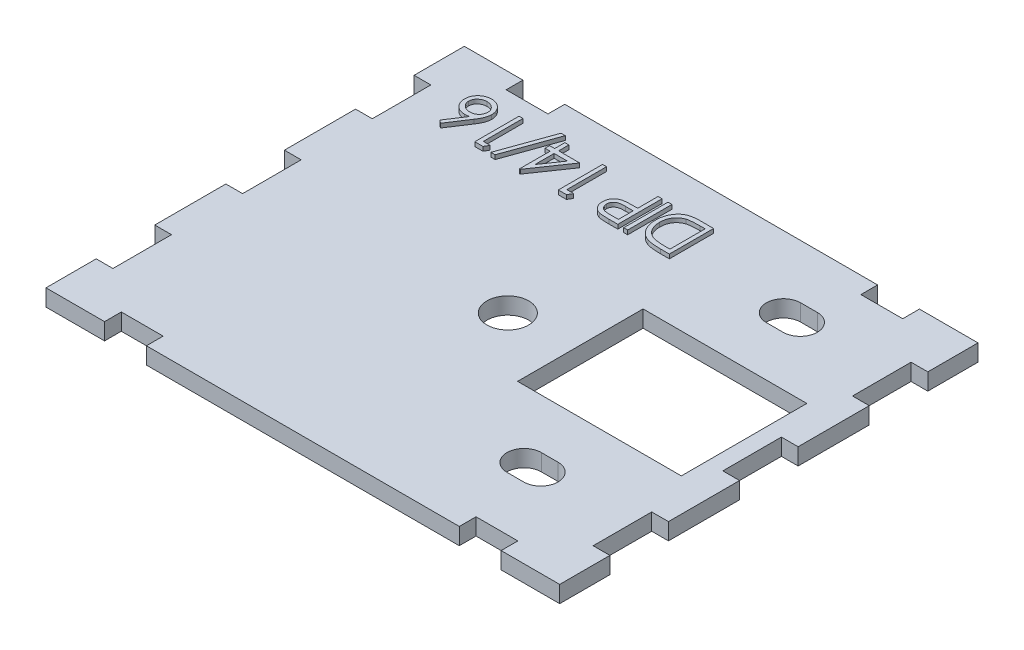
from build123d import *

# Parameters (mm, degrees)
SKETCH2_W           = 100
SKETCH2_H           = 50
BOSS_EXTRUDE1_DEPTH = 2
SKETCH12_W          = 9.8
SKETCH12_H          = 50
SKETCH12_W_2        = 8.8
CUT_EXTRUDE8_DEPTH  = 6
SKETCH13_W          = 2
SKETCH13_H          = 7
SKETCH13_W_2        = 5
SKETCH13_H_2        = 2
CUT_EXTRUDE10_DEPTH = 6
SKETCH15_W          = 6.543059906
SKETCH15_H          = 1
CUT_EXTRUDE13_DEPTH = 10
SKETCH16_R          = 2.5
CUT_EXTRUDE14_DEPTH = 10
SKETCH17_R          = 2.05
CUT_EXTRUDE15_DEPTH = 3.5
SKETCH22_W          = 0.474893163
SKETCH22_H          = 5.291666667
BOSS_EXTRUDE4_DEPTH = 0.5


with BuildPart() as part:
    # Sketch2 → Boss-Extrude1 (new body)
    with BuildSketch(Plane(origin=(0, 0, 0), x_dir=(1, 0, 0), z_dir=(0, 1, 0))):
        Rectangle(SKETCH2_W, SKETCH2_H)
    extrude(amount=BOSS_EXTRUDE1_DEPTH)

    # Sketch12 → Cut-Extrude8 (cut)
    with BuildSketch(Plane(origin=(0, 2, 0), x_dir=(1, 0, 0), z_dir=(0, 1, 0))):
        with Locations((-45.1, 0)):
            Rectangle(SKETCH12_W, SKETCH12_H)
        with Locations((45.6, 0)):
            Rectangle(SKETCH12_W_2, SKETCH12_H)
    extrude(amount=-CUT_EXTRUDE8_DEPTH, mode=Mode.SUBTRACT)

    # Sketch13 → Cut-Extrude10 (cut)
    with BuildSketch(Plane(origin=(0, 2, 0), x_dir=(1, 0, 0), z_dir=(0, 1, 0))):
        with Locations((-29.2, 0)):
            Rectangle(SKETCH13_W, SKETCH13_H)
        Polygon((-30.2, 12), (-30.2, 19), (-30.2, 25), (-40.2, 25), (-40.2, -25), (-30.2, -25), (-30.2, -19), (-30.2, -12), (-30.2, -3.5), (-30.2, 3.5), align=None)
        with Locations((-29.2, 15.5)):
            Rectangle(SKETCH13_W, SKETCH13_H)
        with Locations((21.7, -24)):
            Rectangle(SKETCH13_W_2, SKETCH13_H_2)
        with Locations((30.2, -15.5)):
            Rectangle(SKETCH13_W, SKETCH13_H)
        with Locations((30.2, 0)):
            Rectangle(SKETCH13_W, SKETCH13_H)
        with Locations((30.2, 15.5)):
            Rectangle(SKETCH13_W, SKETCH13_H)
        with Locations((21.7, 24)):
            Rectangle(SKETCH13_W_2, SKETCH13_H_2)
        with Locations((-29.2, -15.5)):
            Rectangle(SKETCH13_W, SKETCH13_H)
        Polygon((41.2, 25), (31.2, 25), (31.2, 19), (31.2, 12), (31.2, 3.5), (31.2, -3.5), (31.2, -12), (31.2, -19), (31.2, -25), (41.2, -25), align=None)
        with Locations((-20.7, 24)):
            Rectangle(SKETCH13_W_2, SKETCH13_H_2)
        with Locations((-20.7, -24)):
            Rectangle(SKETCH13_W_2, SKETCH13_H_2)
    extrude(amount=-CUT_EXTRUDE10_DEPTH, mode=Mode.SUBTRACT)

    # Sketch15 → Cut-Extrude13 (cut)
    with BuildSketch(Plane.XZ):
        Polygon((8.96933351, -7.5), (14.181143059, -7.5), (20.724202965, -7.5), (25.936012514, -7.5), (25.936012514, 5.5), (8.96933351, 5.5), align=None)
        Polygon((27.239237886, -8.5), (20.724202965, -8.5), (20.724202965, -7.5), (25.936012514, -7.5), (25.936012514, 5.5), (8.96933351, 5.5), (8.96933351, -7.5), (14.181143059, -7.5), (14.181143059, -8.5), (7.666108138, -8.5), (7.666108138, 6.5), (27.239237886, 6.5), align=None)
        with Locations((17.452673012, -8)):
            Rectangle(SKETCH15_W, SKETCH15_H)
    extrude(amount=-CUT_EXTRUDE13_DEPTH, mode=Mode.SUBTRACT)

    # Sketch16 → Cut-Extrude14 (cut)
    with BuildSketch(Plane(origin=(0, 0, 0), x_dir=(-1, 0, 0), z_dir=(0, -1, 0))):
        with Locations(Location((0, 0, 0), (0, 0, 90))):
            Circle(SKETCH16_R)
    extrude(amount=-CUT_EXTRUDE14_DEPTH, mode=Mode.SUBTRACT)

    # Sketch17 → Cut-Extrude15 (cut)
    with BuildSketch(Plane(origin=(0, 0, 0), x_dir=(-1, 0, 0), z_dir=(0, -1, 0))):
        with Locations((-18.452672908, -14.5)):
            Circle(SKETCH17_R)
        with Locations((-17.452672908, -14.5)):
            Circle(SKETCH17_R)
        with Locations((-16.452672908, -14.5)):
            Circle(SKETCH17_R)
        with BuildLine():
            ThreePointArc((-16.952672908, -12.511910465), (-16.704582071, -12.46553649), (-16.452672908, -12.45))
            Line((-16.452672908, -12.45), (-17.452672908, -12.45))
            ThreePointArc((-17.452672908, -12.45), (-17.200763745, -12.46553649), (-16.952672908, -12.511910465))
        make_face()
        with BuildLine():
            ThreePointArc((-17.952672908, -12.511910465), (-17.704582071, -12.46553649), (-17.452672908, -12.45))
            Line((-17.452672908, -12.45), (-18.452672908, -12.45))
            ThreePointArc((-18.452672908, -12.45), (-18.200763745, -12.46553649), (-17.952672908, -12.511910465))
        make_face()
        with BuildLine():
            Line((-17.452672856, -16.55), (-16.452672908, -16.55))
            ThreePointArc((-16.452672908, -16.55), (-16.704582071, -16.53446351), (-16.952672908, -16.488089535))
            ThreePointArc((-16.952672908, -16.488089535), (-17.200763719, -16.534463507), (-17.452672856, -16.55))
        make_face()
        with BuildLine():
            ThreePointArc((-17.952672908, -16.488089535), (-18.200763745, -16.53446351), (-18.452672908, -16.55))
            Line((-18.452672908, -16.55), (-17.452672856, -16.55))
            ThreePointArc((-17.452672856, -16.55), (-17.704582045, -16.534463513), (-17.952672908, -16.488089535))
        make_face()
        with Locations((-16.452672903, 16.5)):
            Circle(SKETCH17_R)
        with Locations((-18.452672903, 16.5)):
            Circle(SKETCH17_R)
        with Locations((-17.452672903, 16.5)):
            Circle(SKETCH17_R)
        with BuildLine():
            Line((-17.452672915, 14.45), (-16.452672903, 14.45))
            ThreePointArc((-16.452672903, 14.45), (-16.704582066, 14.46553649), (-16.952672903, 14.511910465))
            ThreePointArc((-16.952672903, 14.511910465), (-17.200763746, 14.465536489), (-17.452672915, 14.45))
        make_face()
        with BuildLine():
            ThreePointArc((-17.952672903, 14.511910465), (-18.20076374, 14.46553649), (-18.452672903, 14.45))
            Line((-18.452672903, 14.45), (-17.452672915, 14.45))
            ThreePointArc((-17.452672915, 14.45), (-17.704582072, 14.465536491), (-17.952672903, 14.511910465))
        make_face()
        with BuildLine():
            ThreePointArc((-17.952672903, 18.488089535), (-17.70458205, 18.534463512), (-17.452672871, 18.55))
            Line((-17.452672871, 18.55), (-18.452672903, 18.55))
            ThreePointArc((-18.452672903, 18.55), (-18.20076374, 18.53446351), (-17.952672903, 18.488089535))
        make_face()
        with BuildLine():
            ThreePointArc((-16.952672903, 18.488089535), (-16.704582066, 18.53446351), (-16.452672903, 18.55))
            Line((-16.452672903, 18.55), (-17.452672871, 18.55))
            ThreePointArc((-17.452672871, 18.55), (-17.200763724, 18.534463508), (-16.952672903, 18.488089535))
        make_face()
    extrude(amount=-CUT_EXTRUDE15_DEPTH, mode=Mode.SUBTRACT)

    # Sketch22 → Boss-Extrude4 (add)
    # profile 1 of 8: a face of its own
    with BuildSketch(Plane(origin=(0, 2, 0), x_dir=(1, 0, 0), z_dir=(0, 1, 0))):
        with BuildLine():
            Line((-23.159052189, 15.112494657), (-23.524762325, 15.399762619))
            Line((-23.524762325, 15.399762619), (-22.126583573, 17.537841879))
            add(Edge.make_bspline(
                [(-22.126583573, 17.537841879), (-22.219671968, 17.523004256), (-22.401251407, 17.494061796), (-22.585047468, 17.489287283), (-22.674618762, 17.486960469)],
                knots=[0, 0, 0, 0, 1.025318673, 2, 2, 2, 2], degree=3))
            add(Edge.make_bspline(
                [(-22.674618762, 17.486960469), (-22.728400989, 17.488406018), (-22.834269702, 17.49125154), (-22.989703794, 17.513149744), (-23.139063263, 17.547659137), (-23.281729012, 17.597963628), (-23.418213242, 17.662223105), (-23.549298709, 17.739237958), (-23.672523131, 17.832984134), (-23.789466337, 17.937708107), (-23.895659433, 18.053689599), (-23.989604348, 18.176787003), (-24.068948676, 18.306990581), (-24.132162742, 18.444271056), (-24.182681976, 18.587553813), (-24.218645522, 18.737397667), (-24.240145071, 18.894055519), (-24.243047785, 19.000614982), (-24.244522275, 19.054743922)],
                knots=[0, 0, 0, 0, 1.043709831, 2.054511743, 3.041122595, 4.01515914, 4.98481438, 5.965901842, 6.960491961, 7.985277438, 9.0096037, 10.00832444, 10.987059228, 11.962929573, 12.936966118, 13.931840027, 14.949438142, 16, 16, 16, 16], degree=3))
            add(Edge.make_bspline(
                [(-24.244522275, 19.054743922), (-24.241765926, 19.128755292), (-24.236345282, 19.27430628), (-24.196736946, 19.487139407), (-24.128885773, 19.6881538), (-24.036650034, 19.877874324), (-23.919260098, 20.052327833), (-23.778459732, 20.209462737), (-23.614944089, 20.346427783), (-23.431968854, 20.46387291), (-23.233959581, 20.55719634), (-23.026333318, 20.626188817), (-22.81087333, 20.667414355), (-22.664546047, 20.672811573), (-22.590876441, 20.675528845)],
                knots=[0, 0, 0, 0, 1.0319111, 2.029359566, 3.00642934, 3.98275322, 4.962714161, 5.929339302, 6.915525103, 7.928435063, 8.953439721, 9.960121214, 10.9730072, 12, 12, 12, 12], degree=3))
            add(Edge.make_bspline(
                [(-22.590876441, 20.675528845), (-22.519667705, 20.673224915), (-22.378615665, 20.668661233), (-22.171176785, 20.627795186), (-21.97149938, 20.562029872), (-21.782151182, 20.469524897), (-21.606444215, 20.354659152), (-21.448040764, 20.217317659), (-21.310949007, 20.057411338), (-21.196443028, 19.877924088), (-21.102738703, 19.686574339), (-21.037266108, 19.484880236), (-20.99469769, 19.277021826), (-20.990317061, 19.135513905), (-20.988112018, 19.064284187)],
                knots=[0, 0, 0, 0, 1.01206923, 2.004731945, 2.994948482, 3.995280086, 4.993424783, 5.973125358, 6.967517142, 7.97830003, 8.994392566, 9.989381197, 10.98793077, 12, 12, 12, 12], degree=3))
            add(Edge.make_bspline(
                [(-20.988112018, 19.064284187), (-20.990029791, 19.009808052), (-20.993943775, 18.89862769), (-21.017301978, 18.729754823), (-21.060143777, 18.557638732), (-21.106507967, 18.411731376), (-21.152515239, 18.290893649), (-21.19517424, 18.195471289), (-21.242872201, 18.094702212), (-21.298780854, 17.990493069), (-21.358048538, 17.87986638), (-21.427279919, 17.766918987), (-21.499523929, 17.647525704), (-21.552448048, 17.568035511), (-21.579608413, 17.527241585)],
                knots=[0, 0, 0, 0, 1.17367173, 2.395347028, 3.66355231, 4.98980831, 5.690886799, 6.447442954, 7.240630024, 8.091733897, 8.994365608, 9.943299771, 10.944512865, 12, 12, 12, 12], degree=3))
            Line((-21.579608413, 17.527241585), (-23.159052189, 15.112494657))
        make_face()
        with BuildLine():
            add(Edge.make_bspline(
                [(-22.574976001, 18.029695511), (-22.534662502, 18.03087597), (-22.455567751, 18.033192021), (-22.339738422, 18.046561522), (-22.230047885, 18.071031437), (-22.126676136, 18.105475267), (-22.028097607, 18.14755673), (-21.935878135, 18.200921224), (-21.849397085, 18.26367671), (-21.770651585, 18.335907419), (-21.698324803, 18.413782574), (-21.636116736, 18.497707287), (-21.58239629, 18.585101291), (-21.538733411, 18.676790235), (-21.50472957, 18.772714198), (-21.480133793, 18.872438601), (-21.466445311, 18.976630388), (-21.464168042, 19.047285492), (-21.463005181, 19.083364716)],
                knots=[0, 0, 0, 0, 1.129540697, 2.216149546, 3.260829642, 4.271906843, 5.264942922, 6.258225651, 7.250175744, 8.252297429, 9.247108021, 10.223125336, 11.173816288, 12.116901384, 13.062424938, 14.020354563, 14.989116641, 16, 16, 16, 16], degree=3))
            add(Edge.make_bspline(
                [(-21.463005181, 19.083364716), (-21.463988153, 19.119113629), (-21.465925219, 19.189561247), (-21.482341495, 19.292994567), (-21.508766599, 19.392212555), (-21.546331833, 19.487424507), (-21.594322411, 19.578485658), (-21.651721669, 19.666496828), (-21.721323215, 19.749115262), (-21.800392034, 19.826850859), (-21.886309432, 19.897985284), (-21.976984215, 19.961583672), (-22.072741738, 20.014371593), (-22.172562209, 20.058494797), (-22.277699679, 20.090910769), (-22.386373704, 20.115745095), (-22.500081835, 20.129318439), (-22.577063515, 20.131620143), (-22.616317147, 20.132793802)],
                knots=[0, 0, 0, 0, 0.98953633, 1.950002717, 2.892353065, 3.828177645, 4.777967117, 5.738732544, 6.732276577, 7.76327951, 8.805689376, 9.818183401, 10.825652611, 11.829169732, 12.834974292, 13.867693979, 14.912718532, 16, 16, 16, 16], degree=3))
            add(Edge.make_bspline(
                [(-22.616317147, 20.132793802), (-22.655570842, 20.131620234), (-22.732552648, 20.129318709), (-22.846259864, 20.115744067), (-22.95493727, 20.090914538), (-23.060062461, 20.05848114), (-23.159928471, 20.014422563), (-23.25576977, 19.961250923), (-23.347310327, 19.89837083), (-23.433171848, 19.826727849), (-23.512570636, 19.749556235), (-23.580572843, 19.665741616), (-23.63982321, 19.579178297), (-23.685983563, 19.487062309), (-23.723969395, 19.392269174), (-23.750265041, 19.292979114), (-23.766716316, 19.189565278), (-23.768648578, 19.119114986), (-23.769629112, 19.083364716)],
                knots=[0, 0, 0, 0, 1.087095469, 2.131941252, 3.164484274, 4.170116773, 5.173462224, 6.180759088, 7.201132453, 8.243363996, 9.274190558, 10.261329848, 11.227346438, 12.172477233, 13.108141724, 14.050330866, 15.010632948, 16, 16, 16, 16], degree=3))
            add(Edge.make_bspline(
                [(-23.769629112, 19.083364716), (-23.768806819, 19.047234237), (-23.767192925, 18.976321857), (-23.748585395, 18.872532474), (-23.723452835, 18.771903275), (-23.682836289, 18.676701171), (-23.634458761, 18.584293153), (-23.572828602, 18.49732141), (-23.502169511, 18.413317685), (-23.420333972, 18.335391229), (-23.331324788, 18.264063045), (-23.236594471, 18.201288289), (-23.137888309, 18.147701805), (-23.033811125, 18.105418248), (-22.925764521, 18.071354019), (-22.813002083, 18.046725423), (-22.695443701, 18.033171205), (-22.61564337, 18.030868833), (-22.574976001, 18.029695511)],
                knots=[0, 0, 0, 0, 0.978317929, 1.920119929, 2.851929572, 3.784133089, 4.71845084, 5.67514162, 6.667477147, 7.690549442, 8.733345855, 9.756283585, 10.767808623, 11.772962645, 12.797066014, 13.836159554, 14.89727653, 16, 16, 16, 16], degree=3))
        make_face(mode=Mode.SUBTRACT)
    # profile 2 of 8: a face of its own
    with BuildSketch(Plane(origin=(0, 2, 0), x_dir=(1, 0, 0), z_dir=(0, 1, 0))):
        Polygon((-18.218679259, 15.248178417), (-19.197086377, 15.248178417), (-19.197086377, 20.539845084), (-18.722193215, 20.539845084), (-18.722193215, 15.79091346), (-17.908090651, 15.79091346), align=None)
    # profile 3 of 8: a face of its own
    with BuildSketch(Plane(origin=(0, 2, 0), x_dir=(1, 0, 0), z_dir=(0, 1, 0))):
        Polygon((-17.134693215, 15.112494657), (-14.921351869, 21.286105768), (-14.421018001, 21.286105768), (-16.634359347, 15.112494657), align=None)
    # profile 4 of 8: a face of its own
    with BuildSketch(Plane(origin=(0, 2, 0), x_dir=(1, 0, 0), z_dir=(0, 1, 0))):
        Polygon((-13.618999772, 15.112494657), (-13.715462446, 15.112494657), (-13.715462446, 18.775956195), (-14.326039369, 18.775956195), (-14.326039369, 19.318691238), (-13.715462446, 19.318691238), (-13.715462446, 20.539845084), (-13.240569283, 20.539845084), (-13.240569283, 19.318691238), (-10.730419711, 19.318691238), align=None)
        Polygon((-13.240569283, 18.775956195), (-13.240569283, 16.477812499), (-11.663245565, 18.775956195), align=None, mode=Mode.SUBTRACT)
    # profile 5 of 8: a face of its own
    with BuildSketch(Plane(origin=(0, 2, 0), x_dir=(1, 0, 0), z_dir=(0, 1, 0))):
        Polygon((-8.232354473, 15.248178417), (-9.210761591, 15.248178417), (-9.210761591, 20.539845084), (-8.735868429, 20.539845084), (-8.735868429, 15.79091346), (-7.921765864, 15.79091346), align=None)
    # profile 6 of 8: a face of its own
    with BuildSketch(Plane(origin=(0, 2, 0), x_dir=(1, 0, 0), z_dir=(0, 1, 0))):
        with BuildLine():
            Line((-2.100932531, 15.248178417), (-3.138701295, 15.248178417))
            add(Edge.make_bspline(
                [(-3.138701295, 15.248178417), (-3.210079688, 15.24825688), (-3.346843861, 15.248407217), (-3.542960671, 15.252965225), (-3.721077765, 15.2590532), (-3.880811079, 15.267492491), (-4.022652085, 15.277465907), (-4.145958954, 15.29145411), (-4.251700903, 15.306059556), (-4.315059463, 15.320908588), (-4.3439547, 15.327680621)],
                knots=[0, 0, 0, 0, 1.415646017, 2.712440637, 3.8905458, 4.950247383, 5.884950622, 6.709939814, 7.411656543, 8, 8, 8, 8], degree=3))
            add(Edge.make_bspline(
                [(-4.3439547, 15.327680621), (-4.380532786, 15.337692681), (-4.452827043, 15.357480878), (-4.557002221, 15.39710916), (-4.656100908, 15.44411866), (-4.750537628, 15.497616299), (-4.838694573, 15.560128491), (-4.923324169, 15.628047242), (-5.002651614, 15.704119349), (-5.075479088, 15.788244656), (-5.142956887, 15.877667251), (-5.199440641, 15.974667362), (-5.249318019, 16.075880016), (-5.288187913, 16.18377635), (-5.318741144, 16.296932148), (-5.340993095, 16.415641918), (-5.355294899, 16.539649576), (-5.35665196, 16.624409671), (-5.357342788, 16.667557758)],
                knots=[0, 0, 0, 0, 0.999333726, 1.975119402, 2.933498163, 3.889020618, 4.832249799, 5.779334906, 6.747801194, 7.724875447, 8.710438469, 9.696133548, 10.679360639, 11.681339199, 12.714023775, 13.766351759, 14.862936069, 16, 16, 16, 16], degree=3))
            add(Edge.make_bspline(
                [(-5.357342788, 16.667557758), (-5.356705634, 16.711067015), (-5.355458999, 16.796195817), (-5.340496758, 16.920735628), (-5.320342777, 17.039750337), (-5.289353186, 17.152976053), (-5.248765085, 17.259740373), (-5.201152101, 17.361674855), (-5.14372462, 17.457045311), (-5.077737794, 17.546197977), (-5.004332408, 17.629216535), (-4.923819037, 17.705499379), (-4.836522726, 17.774599986), (-4.742720907, 17.836673267), (-4.641499111, 17.890279785), (-4.534392522, 17.938293806), (-4.420470171, 17.978617909), (-4.341635656, 17.999830026), (-4.301553525, 18.010614983)],
                knots=[0, 0, 0, 0, 1.121902311, 2.195077645, 3.232258892, 4.234102512, 5.217864754, 6.176164875, 7.132989551, 8.084763148, 9.034132444, 9.988522005, 10.94243251, 11.903244335, 12.886203696, 13.894208494, 14.929344452, 16, 16, 16, 16], degree=3))
            add(Edge.make_bspline(
                [(-4.301553525, 18.010614983), (-4.268401107, 18.017659712), (-4.195745655, 18.033098645), (-4.076096899, 18.050451574), (-3.936719505, 18.064682872), (-3.778087698, 18.077963633), (-3.599831552, 18.085000776), (-3.4023599, 18.09326353), (-3.185004433, 18.097162272), (-3.033405771, 18.097408721), (-2.954256182, 18.097537392)],
                knots=[0, 0, 0, 0, 0.601372724, 1.317943291, 2.144091499, 3.08771165, 4.142394186, 5.309582461, 6.595334295, 8, 8, 8, 8], degree=3))
            Line((-2.954256182, 18.097537392), (-2.575825694, 18.097537392))
            Line((-2.575825694, 18.097537392), (-2.575825694, 20.539845084))
            Line((-2.575825694, 20.539845084), (-2.100932531, 20.539845084))
            Line((-2.100932531, 20.539845084), (-2.100932531, 15.248178417))
        make_face()
        with BuildLine():
            Line((-2.575825694, 15.79091346), (-2.575825694, 17.554802349))
            Line((-2.575825694, 17.554802349), (-3.502291372, 17.566462672))
            add(Edge.make_bspline(
                [(-3.502291372, 17.566462672), (-3.547528212, 17.5664925), (-3.634856998, 17.566550082), (-3.761346729, 17.560421484), (-3.878417492, 17.553754261), (-3.986242138, 17.542971778), (-4.084328526, 17.529820509), (-4.172914136, 17.512237197), (-4.252705925, 17.494303354), (-4.344617228, 17.463184955), (-4.447567528, 17.4162389), (-4.559305061, 17.346119114), (-4.65477562, 17.257785816), (-4.736693945, 17.157394105), (-4.801444786, 17.045594913), (-4.848372528, 16.926308405), (-4.877016247, 16.799987531), (-4.88061652, 16.713641524), (-4.882449625, 16.669677816)],
                knots=[0, 0, 0, 0, 1.160501667, 2.240324542, 3.248665471, 4.168823117, 5.020172044, 5.786515869, 6.485785279, 7.116517804, 8.272762037, 9.381837012, 10.485674779, 11.594342068, 12.695271952, 13.786226926, 14.872841088, 16, 16, 16, 16], degree=3))
            add(Edge.make_bspline(
                [(-4.882449625, 16.669677816), (-4.880534738, 16.627138412), (-4.876728178, 16.54257534), (-4.848609135, 16.418581872), (-4.800947807, 16.300651465), (-4.736641157, 16.189738386), (-4.656685883, 16.089613502), (-4.563114035, 16.003248829), (-4.457381448, 15.933346739), (-4.359794665, 15.886813583), (-4.272462178, 15.859525505), (-4.196971187, 15.839824894), (-4.11130046, 15.826237802), (-4.016260762, 15.81323751), (-3.911973776, 15.802743445), (-3.797776365, 15.795456031), (-3.674048912, 15.791235826), (-3.588157142, 15.791023517), (-3.543632518, 15.79091346)],
                knots=[0, 0, 0, 0, 1.12039168, 2.227199994, 3.330242575, 4.460839274, 5.593542475, 6.693949254, 7.801736126, 8.92216649, 9.528704869, 10.210659466, 10.975987387, 11.81211542, 12.738540127, 13.736887663, 14.826846554, 16, 16, 16, 16], degree=3))
            Line((-3.543632518, 15.79091346), (-2.575825694, 15.79091346))
        make_face(mode=Mode.SUBTRACT)
    # profile 7 of 8: a face of its own
    with BuildSketch(Plane(origin=(0, 2, 0), x_dir=(1, 0, 0), z_dir=(0, 1, 0))):
        with Locations((-1.157930395, 17.89401175)):
            Rectangle(SKETCH22_W, SKETCH22_H)
    # profile 8 of 8: a face of its own
    with BuildSketch(Plane(origin=(0, 2, 0), x_dir=(1, 0, 0), z_dir=(0, 1, 0))):
        with BuildLine():
            Line((4.059110204, 20.539845084), (4.059110204, 15.248178417))
            Line((4.059110204, 15.248178417), (2.990600589, 15.248178417))
            add(Edge.make_bspline(
                [(2.990600589, 15.248178417), (2.897665139, 15.248845718), (2.718114335, 15.250134939), (2.458655247, 15.258355989), (2.218931722, 15.272752196), (1.999079898, 15.294126465), (1.798746565, 15.319781578), (1.61825258, 15.352408477), (1.457305437, 15.39077992), (1.358322072, 15.423507319), (1.31151405, 15.438983706)],
                knots=[0, 0, 0, 0, 1.314317071, 2.539253741, 3.67075822, 4.709970291, 5.662644612, 6.526156501, 7.303037452, 8, 8, 8, 8], degree=3))
            add(Edge.make_bspline(
                [(1.31151405, 15.438983706), (1.250284386, 15.462306224), (1.129213543, 15.508422383), (0.956925114, 15.595547119), (0.79418474, 15.693859614), (0.642277425, 15.805613833), (0.50086845, 15.929381688), (0.368178583, 16.064161799), (0.248011133, 16.21355234), (0.136221489, 16.372917778), (0.038376545, 16.543708371), (-0.047903892, 16.722503207), (-0.121574286, 16.908955371), (-0.179056982, 17.104425318), (-0.226547623, 17.307035637), (-0.258412678, 17.518320336), (-0.279579353, 17.737047608), (-0.281696109, 17.885479957), (-0.282770138, 17.960793602)],
                knots=[0, 0, 0, 0, 0.984696416, 1.947063185, 2.89840987, 3.841051395, 4.778753227, 5.721858861, 6.681155121, 7.65838316, 8.646299769, 9.637283673, 10.641736726, 11.657050558, 12.698485921, 13.768600492, 14.86780186, 16, 16, 16, 16], degree=3))
            add(Edge.make_bspline(
                [(-0.282770138, 17.960793602), (-0.281818558, 18.026200252), (-0.279943369, 18.155090889), (-0.263126086, 18.345051132), (-0.238635474, 18.529361241), (-0.200892726, 18.707211928), (-0.154515313, 18.879800613), (-0.09727376, 19.046310112), (-0.029427985, 19.206853596), (0.049253843, 19.360155912), (0.135407236, 19.505844287), (0.2292855, 19.641610381), (0.327674304, 19.768951073), (0.434162066, 19.884989597), (0.545223084, 19.993339426), (0.664634698, 20.089194152), (0.788657989, 20.177003811), (0.921018977, 20.254101774), (1.062803633, 20.322682703), (1.217715575, 20.38059971), (1.385189418, 20.430441608), (1.566334877, 20.470152222), (1.760547814, 20.502160991), (1.968354698, 20.523477188), (2.189366395, 20.53793223), (2.341130783, 20.539195085), (2.419244753, 20.539845084)],
                knots=[0, 0, 0, 0, 1.105894396, 2.179280415, 3.222964075, 4.248423888, 5.251546139, 6.243661943, 7.223682738, 8.196462441, 9.155694589, 10.083899862, 10.986397372, 11.874737962, 12.745335529, 13.607670254, 14.461432187, 15.313100333, 16.195087267, 17.121790994, 18.106827133, 19.14775296, 20.255889161, 21.433815148, 22.679170477, 24, 24, 24, 24], degree=3))
            Line((2.419244753, 20.539845084), (4.059110204, 20.539845084))
        make_face()
        with BuildLine():
            Line((3.584217041, 19.997110041), (2.976820207, 19.997110041))
            add(Edge.make_bspline(
                [(2.976820207, 19.997110041), (2.889540408, 19.996734943), (2.721669391, 19.996013492), (2.480281705, 19.98968284), (2.259725951, 19.979338482), (2.059970812, 19.964861876), (1.881129072, 19.945708137), (1.722826974, 19.924352629), (1.585583429, 19.897746959), (1.502535352, 19.873630628), (1.464158281, 19.86248631)],
                knots=[0, 0, 0, 0, 1.375205317, 2.645023457, 3.804390687, 4.853969522, 5.800190428, 6.637939096, 7.370582563, 8, 8, 8, 8], degree=3))
            add(Edge.make_bspline(
                [(1.464158281, 19.86248631), (1.415854374, 19.845476297), (1.320400297, 19.811862553), (1.183011593, 19.750524854), (1.054812317, 19.677957626), (0.93366525, 19.596817328), (0.820348968, 19.505851075), (0.715388227, 19.404769574), (0.617953968, 19.294743066), (0.529606207, 19.175400814), (0.449702666, 19.048066979), (0.380666269, 18.912883401), (0.322469368, 18.770608682), (0.27472268, 18.62173782), (0.237496636, 18.466182211), (0.211288036, 18.30355149), (0.195046874, 18.133909881), (0.193108267, 18.018425372), (0.192123024, 17.959733572)],
                knots=[0, 0, 0, 0, 0.998420628, 1.972994, 2.929372424, 3.86770908, 4.81360496, 5.759023883, 6.706048443, 7.676227424, 8.651287839, 9.634325482, 10.632389399, 11.645655052, 12.680158286, 13.74837235, 14.855672678, 16, 16, 16, 16], degree=3))
            add(Edge.make_bspline(
                [(0.192123024, 17.959733572), (0.192899893, 17.897846419), (0.194426059, 17.776268559), (0.213576683, 17.597872612), (0.241621998, 17.426319709), (0.281962995, 17.261486341), (0.334080085, 17.103586959), (0.396442407, 16.951729499), (0.472160056, 16.807868222), (0.557880439, 16.670784678), (0.654117268, 16.542554911), (0.76044364, 16.4246812), (0.875738409, 16.316943975), (0.999470216, 16.219171701), (1.133369041, 16.133103123), (1.275169053, 16.05653786), (1.426867694, 15.991483459), (1.532419828, 15.956895335), (1.58606166, 15.939317573)],
                knots=[0, 0, 0, 0, 1.122272916, 2.204715076, 3.251197285, 4.274229216, 5.279697671, 6.265416158, 7.248880903, 8.225321784, 9.195852973, 10.153576302, 11.101466393, 12.055578741, 13.010401466, 13.985536859, 14.976245305, 16, 16, 16, 16], degree=3))
            add(Edge.make_bspline(
                [(1.58606166, 15.939317573), (1.630437798, 15.927046307), (1.724793642, 15.900954229), (1.878765213, 15.872492059), (2.052052403, 15.847387638), (2.24542457, 15.826133221), (2.458661288, 15.810882152), (2.691926555, 15.799435045), (2.945321195, 15.791714303), (3.120978121, 15.791187091), (3.212146729, 15.79091346)],
                knots=[0, 0, 0, 0, 0.674548936, 1.434276114, 2.292660221, 3.240891867, 4.284742987, 5.42552168, 6.663806718, 8, 8, 8, 8], degree=3))
            Line((3.212146729, 15.79091346), (3.584217041, 15.79091346))
            Line((3.584217041, 15.79091346), (3.584217041, 19.997110041))
        make_face(mode=Mode.SUBTRACT)
    extrude(amount=BOSS_EXTRUDE4_DEPTH)


solid = part.part
